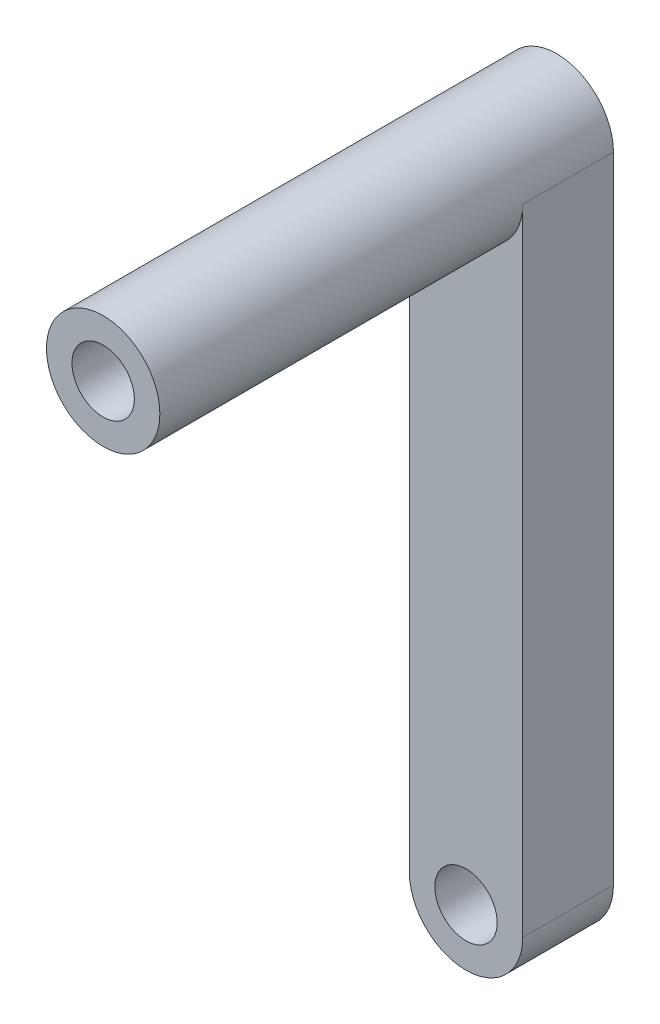
from build123d import *

# Parameters (mm, degrees)
SKETCH1_R           = 1.375
BOSS_EXTRUDE3_DEPTH = 4
SKETCH1_6_R         = 1.375
BOSS_EXTRUDE4_DEPTH = 20


with BuildPart() as part:
    # Sketch1 → Boss-Extrude3 (new body)
    with BuildSketch(Plane.XY):
        with BuildLine():
            Line((-2.5, 17.852941176), (-2.5, -10.147058824))
            ThreePointArc((-2.5, -10.147058824), (0, -12.647058824), (2.5, -10.147058824))
            Line((2.5, -10.147058824), (2.5, 17.852941176))
            ThreePointArc((2.5, 17.852941176), (0, 15.352941176), (-2.5, 17.852941176))
        make_face()
        with Locations((0, -10.147058824)):
            Circle(SKETCH1_R, mode=Mode.SUBTRACT)
    extrude(amount=BOSS_EXTRUDE3_DEPTH)

    # Sketch1<6> → Boss-Extrude4 (add)
    with BuildSketch(Plane.XY):
        with BuildLine():
            ThreePointArc((2.5, 17.852941176), (0, 20.352941176), (-2.5, 17.852941176))
            ThreePointArc((-2.5, 17.852941176), (0, 15.352941176), (2.5, 17.852941176))
        make_face()
        with Locations((0, 17.852941176)):
            Circle(SKETCH1_6_R, mode=Mode.SUBTRACT)
    extrude(amount=BOSS_EXTRUDE4_DEPTH)


solid = part.part
